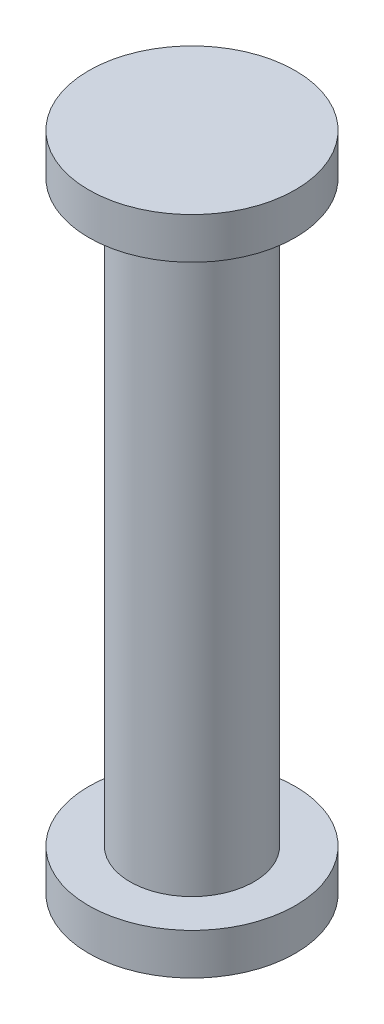
from build123d import *


with BuildPart() as part:
    # Эскиз1 → Повернуть1 (revolve)
    with BuildSketch(Plane.XY, mode=Mode.PRIVATE) as revolve_1_sk:
        Polygon((0, 0), (0, 16), (-2.5, 16), (-2.5, 15), (-1.5, 15), (-1.5, 1), (-2.5, 1), (-2.5, 0), align=None)
    revolve(revolve_1_sk.sketch.rotate(Axis((0, 0, 0), (0, 1, 0)), 270), axis=Axis((0, 0, 0), (0, 1, 0)))


solid = part.part
